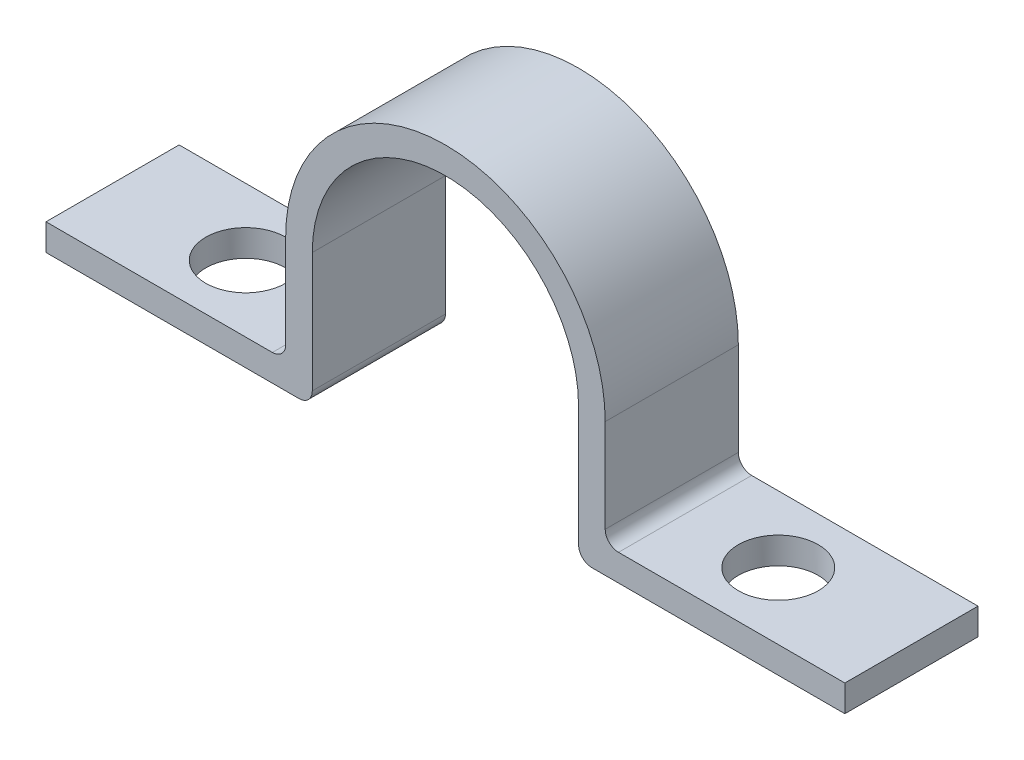
from build123d import *

# Parameters (mm, degrees)
EXTRUDE_1_DEPTH          = 5
CUT_EXTRUDE_1_DEPTH      = 19.708286934
CUT_EXTRUDE_1_DEPTH_BACK = 19.708286934
SKETCH_2_R               = 1.5


with BuildPart() as part:
    # 草图1 → 凸台-拉伸1 (new body)
    with BuildSketch(Plane.XY):
        with BuildLine():
            Line((-5, 5), (-5, 0.5))
            ThreePointArc((-5, 0.5), (-5.146446609, 0.146446609), (-5.5, 0))
            Line((-5.5, 0), (-15, 0))
            Line((-15, 0), (-15, 1))
            Line((-15, 1), (-6.5, 1))
            ThreePointArc((-6.5, 1), (-6.146446609, 1.146446609), (-6, 1.5))
            Line((-6, 1.5), (-6, 5))
            ThreePointArc((-6, 5), (0, 11), (6, 5))
            Line((6, 5), (6, 1.5))
            ThreePointArc((6, 1.5), (6.146446609, 1.146446609), (6.5, 1))
            Line((6.5, 1), (15, 1))
            Line((15, 1), (15, 0))
            Line((15, 0), (5.5, 0))
            ThreePointArc((5.5, 0), (5.146446609, 0.146446609), (5, 0.5))
            Line((5, 0.5), (5, 5))
            ThreePointArc((5, 5), (0, 10), (-5, 5))
        make_face()
    extrude(amount=EXTRUDE_1_DEPTH)

    # 草图2 → 切除-拉伸1 (cut, two sides: drawn at the far end of the back side and taken through both)
    with BuildSketch(Plane(origin=(0, 1, 0), x_dir=(1, 0, 0), z_dir=(0, 1, 0)).offset(-CUT_EXTRUDE_1_DEPTH_BACK)):
        with Locations(Location((-10, -2.5, 0), (0, 0, 270))):
            Circle(SKETCH_2_R)
        with Locations(Location((10, -2.5, 0), (0, 0, 270))):
            Circle(SKETCH_2_R)
    extrude(amount=CUT_EXTRUDE_1_DEPTH + CUT_EXTRUDE_1_DEPTH_BACK, mode=Mode.SUBTRACT)


solid = part.part
